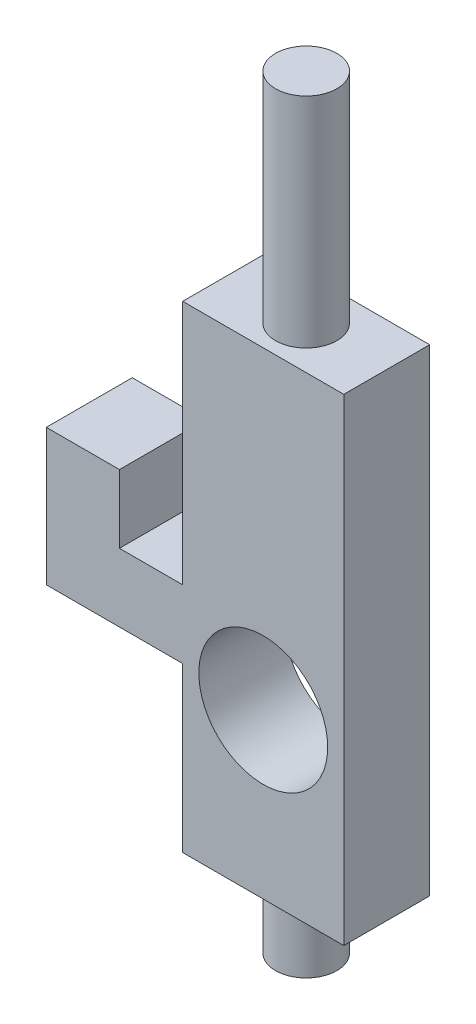
from build123d import *

# Parameters (mm, degrees)
SKETCH1_R           = 2.855
BOSS_EXTRUDE1_DEPTH = 6.35
SKETCH2_W           = 15
SKETCH2_H           = 8
BOSS_EXTRUDE2_DEPTH = 44.45
SKETCH3_R           = 6
CUT_EXTRUDE1_DEPTH  = 25.4
SKETCH4_R           = 2.855
BOSS_EXTRUDE3_DEPTH = 20.32
SKETCH5_W           = 8
SKETCH5_H           = 6.35
BOSS_EXTRUDE4_DEPTH = 12.7
SKETCH6_W           = 6.812329396
SKETCH6_H           = 8
BOSS_EXTRUDE5_DEPTH = 6.35


with BuildPart() as part:
    # Sketch1 → Boss-Extrude1 (new body)
    with BuildSketch(Plane(origin=(0, 0, 0), x_dir=(1, 0, 0), z_dir=(0, 1, 0))):
        with Locations(Location((0, 0, 0), (0, 0, 270))):
            Circle(SKETCH1_R)
    extrude(amount=BOSS_EXTRUDE1_DEPTH)

    # Sketch2 → Boss-Extrude2 (add)
    with BuildSketch(Plane(origin=(0, 6.35, 0), x_dir=(1, 0, 0), z_dir=(0, 1, 0))):
        Rectangle(SKETCH2_W, SKETCH2_H)
    extrude(amount=BOSS_EXTRUDE2_DEPTH)

    # Sketch3 → Cut-Extrude1 (cut)
    with BuildSketch(Plane.XY.offset(4)):
        with Locations((0, 21.59)):
            Circle(SKETCH3_R)
    extrude(amount=-CUT_EXTRUDE1_DEPTH, mode=Mode.SUBTRACT)

    # Sketch4 → Boss-Extrude3 (add)
    with BuildSketch(Plane(origin=(0, 50.8, 0), x_dir=(1, 0, 0), z_dir=(0, 1, 0))):
        with Locations(Location((0, 0, 0), (0, 0, 270))):
            Circle(SKETCH4_R)
    extrude(amount=BOSS_EXTRUDE3_DEPTH)

    # Sketch5 → Boss-Extrude4 (add)
    with BuildSketch(Plane.ZY.offset(7.5)):
        with Locations((0, 24.765)):
            Rectangle(SKETCH5_W, SKETCH5_H)
    extrude(amount=BOSS_EXTRUDE4_DEPTH)

    # Sketch6 → Boss-Extrude5 (add)
    with BuildSketch(Plane(origin=(0, 27.94, 0), x_dir=(1, 0, 0), z_dir=(0, 1, 0))):
        with Locations((-16.793835302, 0)):
            Rectangle(SKETCH6_W, SKETCH6_H)
    extrude(amount=BOSS_EXTRUDE5_DEPTH)


solid = part.part
